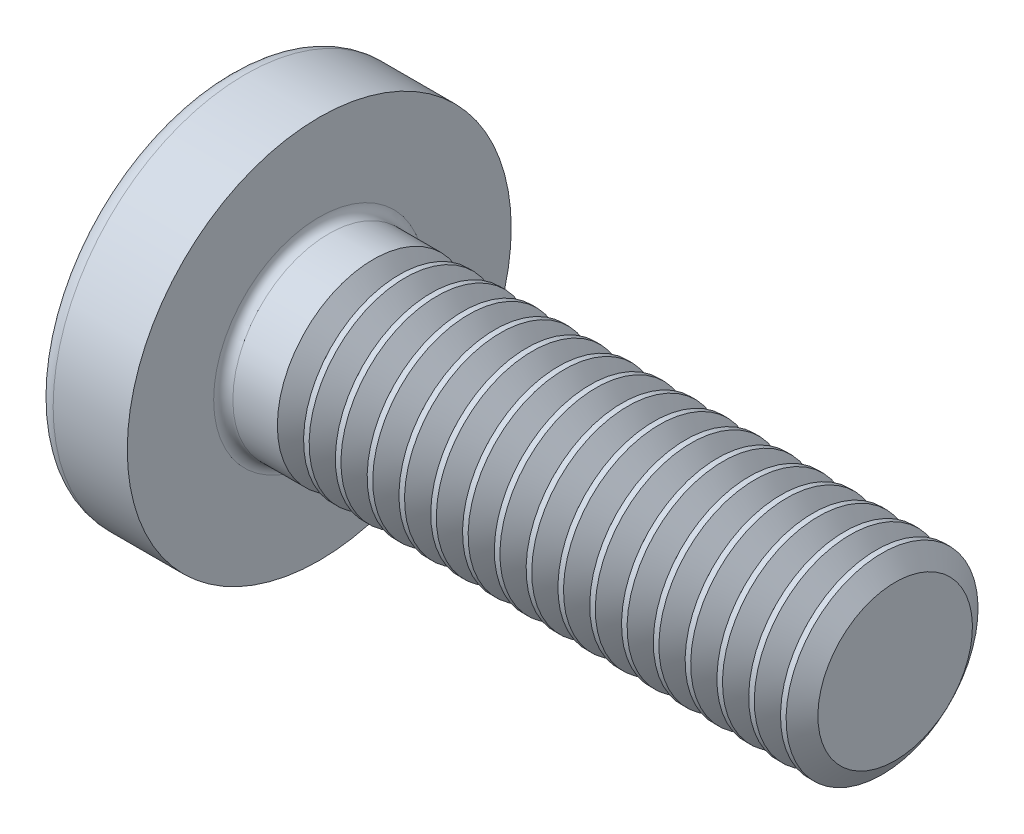
from build123d import *

# Parameters (mm, degrees)
FILLET1_R       = 0.2
RECPAT_COUNT    = 2
RECPAT_ANGLE    = 90
THDSCHPAT_COUNT = 17
THDSCHPAT_PITCH = 0.6625


with BuildPart() as part:
    # BodySke → Base-Revolve (revolve)
    with BuildSketch(Plane.XY, mode=Mode.PRIVATE) as base_revolve_sk:
        with BuildLine():
            Line((3.1, 2), (3.1, 4))
            Line((3.1, 4), (1.555305874, 4))
            ThreePointArc((1.555305874, 4), (1.392873227, 3.961271902), (1.265388955, 3.853420195))
            ThreePointArc((1.265388955, 3.853420195), (0.324444487, 2.027933456), (0, 0))
            Line((0, 0), (15.1, 0))
            Line((15.1, 0), (15.1, 2))
            Line((15.1, 2), (3.1, 2))
        make_face()
    revolve(base_revolve_sk.sketch.rotate(Axis((1.555305874, 0, 0), (1, 0, 0)), 90), axis=Axis((1.555305874, 0, 0), (1, 0, 0)))

    # Fillet1
    fillet1_edges = [part.edges().sort_by_distance(p)[0] for p in [
        (3.1, 0, -2),
    ]]
    fillet(fillet1_edges, radius=FILLET1_R)

    # Sketch3 → Recess section 0
    with BuildSketch(Plane(origin=(0, 0, 0), x_dir=(0, 0, -1), z_dir=(1, 0, 0))):
        with BuildLine():
            Line((0.515, -2.15), (-0.515, -2.15))
            Line((-0.515, -2.15), (-0.515, 2.15))
            Line((-0.515, 2.15), (0.515, 2.15))
            Line((0.515, 2.15), (0.515, -2.15))
        make_face()
    # Sketch4 → Recess section 1
    with BuildSketch(Plane(origin=(2.34, 0, 0), x_dir=(0, 0, -1), z_dir=(1, 0, 0))):
        with BuildLine():
            Line((0.515, -0.983319232), (-0.515, -0.983319232))
            Line((-0.515, -0.983319232), (-0.515, 0.983319232))
            Line((-0.515, 0.983319232), (0.515, 0.983319232))
            Line((0.515, 0.983319232), (0.515, -0.983319232))
        make_face()
    recess = loft(mode=Mode.SUBTRACT)

    # RecPat: Recess ×2 about axis
    recpat_axis = Axis((0, 0, 0), (1, 0, 0))
    for i in range(1, RECPAT_COUNT):
        add(recess.rotate(recpat_axis, i * RECPAT_ANGLE / (RECPAT_COUNT - 1)), mode=Mode.SUBTRACT)

    # RecCorSke → RecessCore (revolve, cut)
    with BuildSketch(Plane.XY, mode=Mode.PRIVATE) as recesscore_sk:
        Polygon((0, 0), (0, 1.01462874), (2.34, 0.851), (2.616506661, 0), align=None)
    revolve(recesscore_sk.sketch.rotate(Axis((-3.175, 0, 0), (1, 0, 0)), 14.547591759), axis=Axis((-3.175, 0, 0), (1, 0, 0)), mode=Mode.SUBTRACT)

    # ThdSchSke → ThreadSchematic (revolve, cut)
    with BuildSketch(Plane.XY, mode=Mode.PRIVATE) as threadschematic_sk:
        Polygon((4.5, -1.61), (4.22691906, -2), (4.22691906, -2.5), (4.77308094, -2.5), (4.77308094, -2), align=None)
    threadschematic = revolve(threadschematic_sk.sketch.rotate(Axis((-3.175, 0, 0), (1, 0, 0)), 270), axis=Axis((-3.175, 0, 0), (1, 0, 0)), mode=Mode.SUBTRACT)

    # ThdSchPat: ThreadSchematic ×17
    with Locations(*[(i * THDSCHPAT_PITCH, 0, 0) for i in range(1, THDSCHPAT_COUNT)]):
        add(threadschematic, mode=Mode.SUBTRACT)


solid = part.part
